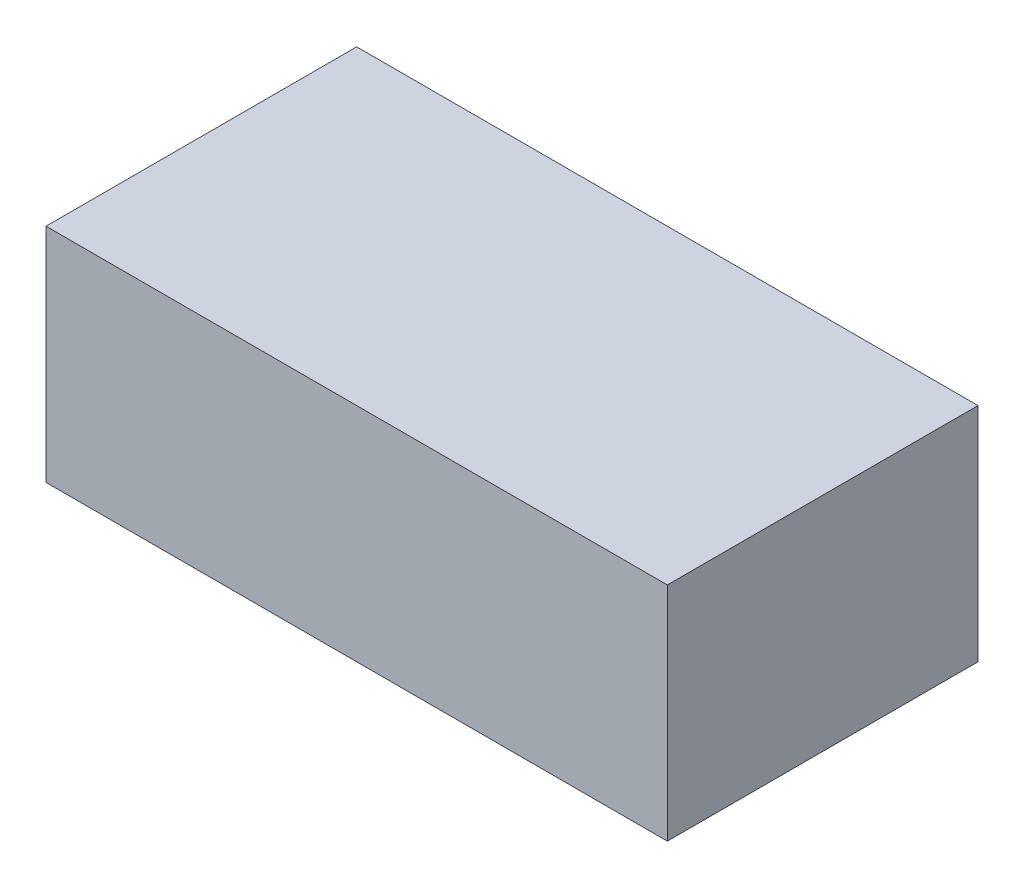
from build123d import *

# Parameters (mm, degrees)
SKETCH1_W           = 140
SKETCH1_H           = 70
BOSS_EXTRUDE1_DEPTH = 50
SHELL1_T            = -2


with BuildPart() as part:
    # Sketch1 → Boss-Extrude1 (new body)
    with BuildSketch(Plane(origin=(0, 0, 0), x_dir=(1, 0, 0), z_dir=(0, 1, 0))):
        Rectangle(SKETCH1_W, SKETCH1_H)
    extrude(amount=BOSS_EXTRUDE1_DEPTH)

    # Shell1
    shell1_openings = [part.faces().sort_by_distance(p)[0] for p in [
        (0, 0, 0),
    ]]
    offset(amount=SHELL1_T, openings=shell1_openings, kind=Kind.INTERSECTION)


solid = part.part
